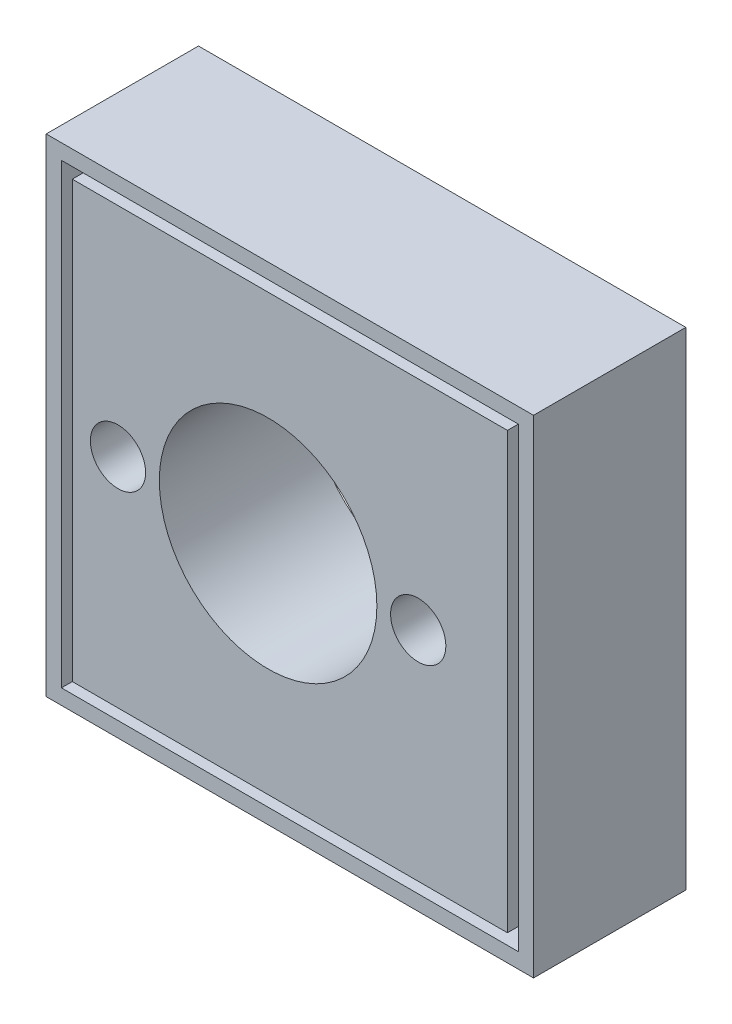
from build123d import *

# Parameters (mm, degrees)
SKETCH2_W           = 112
SKETCH2_H           = 112
SKETCH2_R           = 25
BOSS_EXTRUDE1_DEPTH = 15
SKETCH3_W           = 112
SKETCH3_H           = 112
SKETCH3_W_2         = 105
SKETCH3_H_2         = 105
SKETCH3_W_3         = 100
SKETCH3_H_3         = 100
SKETCH3_R           = 6.35
SKETCH3_R_2         = 25
BOSS_EXTRUDE2_DEPTH = 20


with BuildPart() as part:
    # Sketch2 → Boss-Extrude1 (new body)
    with BuildSketch(Plane.XY):
        Rectangle(SKETCH2_W, SKETCH2_H)
        with Locations((-5, 0)):
            Circle(SKETCH2_R, mode=Mode.SUBTRACT)
    extrude(amount=BOSS_EXTRUDE1_DEPTH)

    # Sketch3 → Boss-Extrude2 (add)
    # profile 1 of 2: a face of its own
    with BuildSketch(Plane.XY.offset(15)):
        Rectangle(SKETCH3_W, SKETCH3_H)
        Rectangle(SKETCH3_W_2, SKETCH3_H_2, mode=Mode.SUBTRACT)
    # profile 2 of 2: a face of its own
    with BuildSketch(Plane.XY.offset(15)):
        Rectangle(SKETCH3_W_3, SKETCH3_H_3)
        with Locations((-39.5, 0)):
            Circle(SKETCH3_R, mode=Mode.SUBTRACT)
        with Locations((-5, 0)):
            Circle(SKETCH3_R_2, mode=Mode.SUBTRACT)
        with Locations((29.5, 0)):
            Circle(SKETCH3_R, mode=Mode.SUBTRACT)
    extrude(amount=BOSS_EXTRUDE2_DEPTH)


solid = part.part
